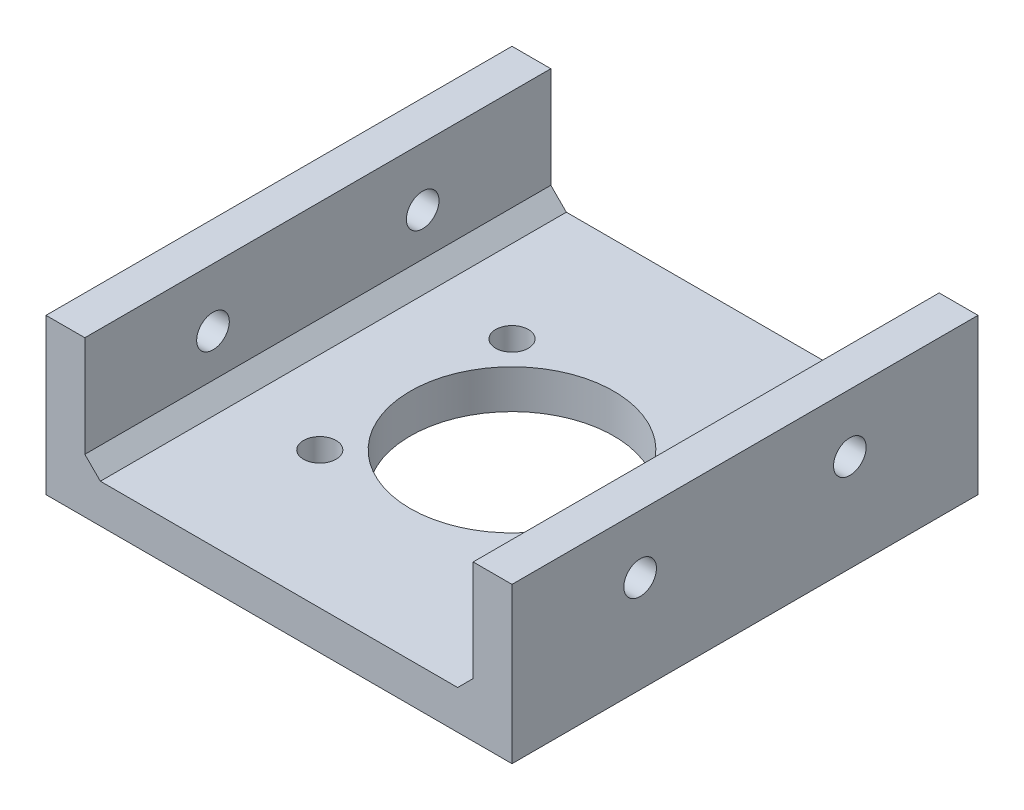
from build123d import *

# Parameters (mm, degrees)
SKETCH_1_W           = 60
SKETCH_1_H           = 60
SKETCH_1_R           = 13.1
SKETCH_1_R_2         = 2.1
EXTRUDE_1_DEPTH      = 5
SKETCH_2_W           = 5
SKETCH_2_H           = 60
EXTRUDE_2_DEPTH      = 15
SKETCH_4_R           = 2.1
CUT_EXTRUDE_M4_DEPTH = 71
CHAMFER_1_SIZE       = 2


with BuildPart() as part:
    # 草图1 → 凸台-拉伸1 (new body)
    with BuildSketch(Plane(origin=(0, 0, 0), x_dir=(1, 0, 0), z_dir=(0, 1, 0))):
        Rectangle(SKETCH_1_W, SKETCH_1_H)
        with Locations(Location((0, 0, 0), (0, 0, 270))):
            Circle(SKETCH_1_R, mode=Mode.SUBTRACT)
        with Locations(Location((-12.374368671, -12.374368671, 0), (0, 0, 270))):
            Circle(SKETCH_1_R_2, mode=Mode.SUBTRACT)
        with Locations(Location((12.374368671, -12.374368671, 0), (0, 0, 90))):
            Circle(SKETCH_1_R_2, mode=Mode.SUBTRACT)
        with Locations(Location((-12.374368671, 12.374368671, 0), (0, 0, 90))):
            Circle(SKETCH_1_R_2, mode=Mode.SUBTRACT)
        with Locations(Location((12.374368671, 12.374368671, 0), (0, 0, 270))):
            Circle(SKETCH_1_R_2, mode=Mode.SUBTRACT)
    extrude(amount=EXTRUDE_1_DEPTH)

    # 草图2 → 凸台-拉伸2 (add)
    with BuildSketch(Plane(origin=(0, 5, 0), x_dir=(1, 0, 0), z_dir=(0, 1, 0))):
        with Locations((-27.5, 0)):
            Rectangle(SKETCH_2_W, SKETCH_2_H)
        with Locations((27.5, 0)):
            Rectangle(SKETCH_2_W, SKETCH_2_H)
    extrude(amount=EXTRUDE_2_DEPTH)

    # 草图4 → M4通孔 (cut, through all)
    with BuildSketch(Plane.ZY.offset(30)):
        with Locations((-13.5, 12.5)):
            Circle(SKETCH_4_R)
        with Locations(Location((13.5, 12.5, 0), (0, 0, 180))):
            Circle(SKETCH_4_R)
    extrude(amount=-CUT_EXTRUDE_M4_DEPTH, mode=Mode.SUBTRACT)

    # 倒角1
    chamfer_1_edges = [part.edges().sort_by_distance(p)[0] for p in [
        (-25, 5, 0),
        (25, 5, 0),
    ]]
    chamfer(chamfer_1_edges, length=CHAMFER_1_SIZE)


solid = part.part
